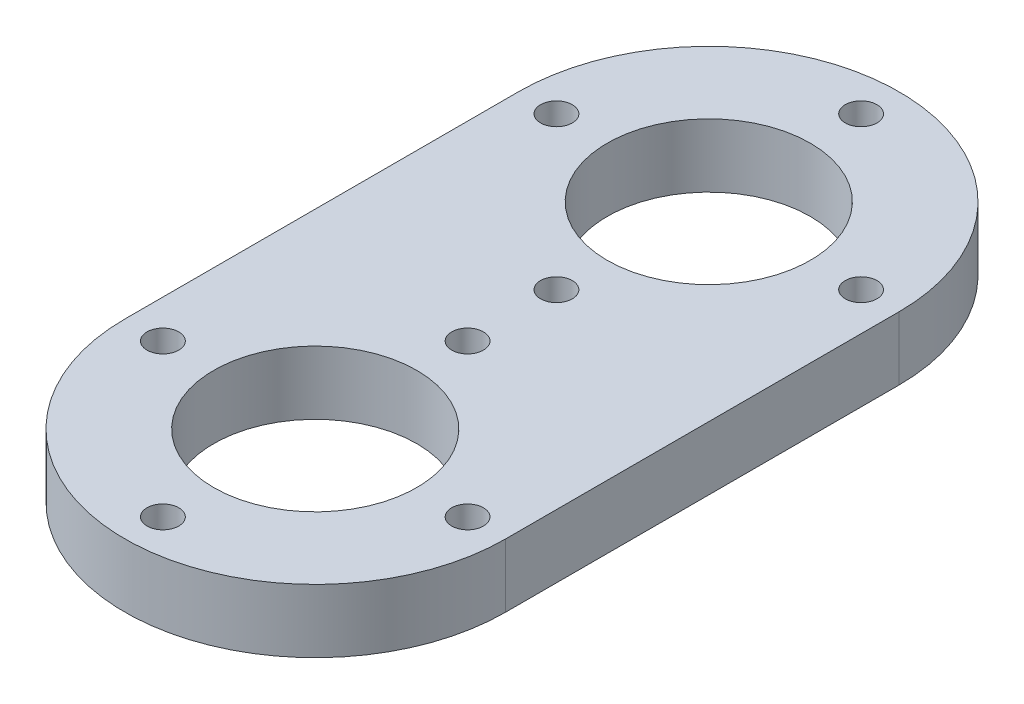
from build123d import *

# Parameters (mm, degrees)
CROQUIS1_R              = 16
SALIENTE_EXTRUIR1_DEPTH = 10
SKETCH1_R               = 2.5
CUT_EXTRUDE1_DEPTH      = 69.709533545
CIRPATTERN1_COUNT       = 4
MIRROR1_COPY_1_SKETCH_R = 2.5
MIRROR1_COPY_1_DEPTH    = 69.709533545
MIRROR1_COPY_2_SKETCH_R = 2.5
MIRROR1_COPY_2_DEPTH    = 69.709533545
MIRROR1_COPY_3_SKETCH_R = 2.5
MIRROR1_COPY_3_DEPTH    = 69.709533545


with BuildPart() as part:
    # Croquis1 → Saliente-Extruir1 (new body)
    with BuildSketch(Plane(origin=(0, 0, 0), x_dir=(1, 0, 0), z_dir=(0, 1, 0))):
        with BuildLine():
            Line((30, 31), (30, -31))
            ThreePointArc((30, -31), (0, -61), (-30, -31))
            Line((-30, -31), (-30, 31))
            ThreePointArc((-30, 31), (0, 61), (30, 31))
        make_face()
        with Locations(Location((0, -31, 0), (0, 0, 270))):
            Circle(CROQUIS1_R, mode=Mode.SUBTRACT)
        with Locations(Location((0, 31, 0), (0, 0, 270))):
            Circle(CROQUIS1_R, mode=Mode.SUBTRACT)
    extrude(amount=SALIENTE_EXTRUIR1_DEPTH)

    # Sketch1 → Cut-Extrude1 (cut, through all)
    with BuildSketch(Plane(origin=(0, 10, 0), x_dir=(1, 0, 0), z_dir=(0, 1, 0))):
        with Locations(Location((24, 31, 0), (0, 0, 270))):
            Circle(SKETCH1_R)
    cut_extrude1 = extrude(amount=-CUT_EXTRUDE1_DEPTH, mode=Mode.SUBTRACT)

    # CirPattern1: Cut-Extrude1 ×4 about axis
    cirpattern1_axis = Axis((0, 0, -31), (0, 1, 0))
    for i in range(1, CIRPATTERN1_COUNT):
        add(cut_extrude1.rotate(cirpattern1_axis, i * 360 / CIRPATTERN1_COUNT), mode=Mode.SUBTRACT)

    # Mirror1: Cut-Extrude1 across plane
    add(cut_extrude1.mirror(Plane.XY), mode=Mode.SUBTRACT)

    # Mirror1 copy 1 sketch → Mirror1 copy 1 (cut, through all)
    with BuildSketch(Plane(origin=(31, 10, 31), x_dir=(0, 0, 1), z_dir=(0, 1, 0))):
        with Locations((24, -31)):
            Circle(MIRROR1_COPY_1_SKETCH_R)
    extrude(amount=-MIRROR1_COPY_1_DEPTH, mode=Mode.SUBTRACT)

    # Mirror1 copy 2 sketch → Mirror1 copy 2 (cut, through all)
    with BuildSketch(Plane(origin=(0, 10, 62), x_dir=(-1, 0, 0), z_dir=(0, 1, 0))):
        with Locations((24, -31)):
            Circle(MIRROR1_COPY_2_SKETCH_R)
    extrude(amount=-MIRROR1_COPY_2_DEPTH, mode=Mode.SUBTRACT)

    # Mirror1 copy 3 sketch → Mirror1 copy 3 (cut, through all)
    with BuildSketch(Plane(origin=(-31, 10, 31), x_dir=(0, 0, -1), z_dir=(0, 1, 0))):
        with Locations((24, -31)):
            Circle(MIRROR1_COPY_3_SKETCH_R)
    extrude(amount=-MIRROR1_COPY_3_DEPTH, mode=Mode.SUBTRACT)


solid = part.part
